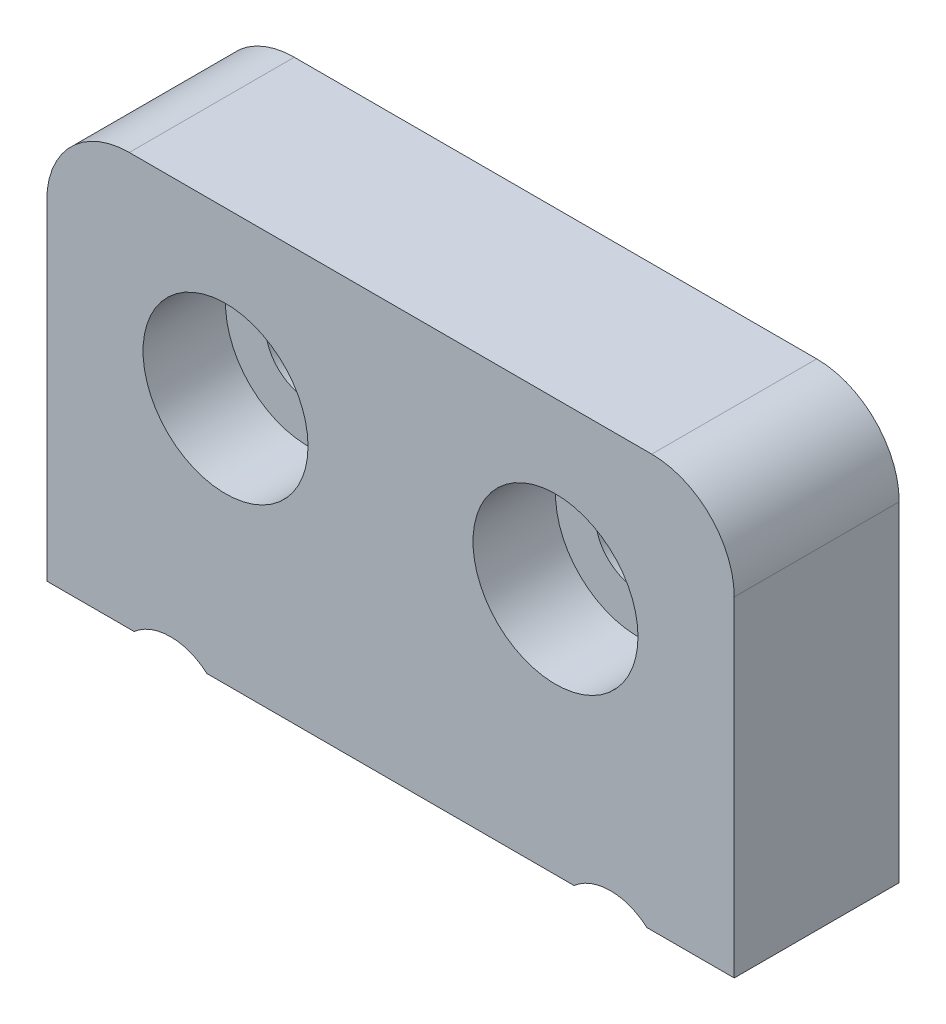
from build123d import *

# Parameters (mm, degrees)
SKETCH_1_W          = 25
SKETCH_1_H          = 15
SKETCH_1_R          = 1.55
EXTRUDE_1_DEPTH     = 6
SKETCH_3_R          = 1.5
CUT_EXTRUDE_1_DEPTH = 6
CUT_EXTRUDE_2_DEPTH = 30.765752132
FILLET_1_R          = 3
SKETCH_5_R          = 3
CUT_EXTRUDE_3_DEPTH = 3


with BuildPart() as part:
    # ｽｹｯﾁ1 → ﾎﾞｽ - 押し出し1 (new body)
    with BuildSketch(Plane.XY):
        with Locations((12.5, 7.5)):
            Rectangle(SKETCH_1_W, SKETCH_1_H)
        with Locations((6.5, 9)):
            Circle(SKETCH_1_R, mode=Mode.SUBTRACT)
        with Locations(Location((18.5, 9, 0), (0, 0, 180))):
            Circle(SKETCH_1_R, mode=Mode.SUBTRACT)
    extrude(amount=EXTRUDE_1_DEPTH)

    # ｽｹｯﾁ3 → ｶｯﾄ - 押し出し1 (cut)
    with BuildSketch(Plane.XZ):
        with Locations(Location((4.5, 3, 0), (0, 0, 270))):
            Circle(SKETCH_3_R)
        with Locations(Location((20.5, 3, 0), (0, 0, 90))):
            Circle(SKETCH_3_R)
    extrude(amount=-CUT_EXTRUDE_1_DEPTH, mode=Mode.SUBTRACT)

    # ｽｹｯﾁ4 → ｶｯﾄ - 押し出し2 (cut, through all)
    with BuildSketch(Plane.XY.offset(6)):
        with BuildLine():
            Line((3.177124344, 0), (5.822875656, 0))
            ThreePointArc((5.822875656, 0), (4.5, 0.5), (3.177124344, 0))
        make_face()
        with BuildLine():
            Line((21.822875656, 0), (19.177124344, 0))
            ThreePointArc((19.177124344, 0), (20.5, 0.5), (21.822875656, 0))
        make_face()
    extrude(amount=-CUT_EXTRUDE_2_DEPTH, mode=Mode.SUBTRACT)

    # ﾌｨﾚｯﾄ1
    fillet_1_edges = [part.edges().sort_by_distance(p)[0] for p in [
        (0, 15, 3),
        (25, 15, 3),
    ]]
    fillet(fillet_1_edges, radius=FILLET_1_R)

    # ｽｹｯﾁ5 → ｶｯﾄ - 押し出し3 (cut)
    with BuildSketch(Plane.XY.offset(6)):
        with Locations((6.5, 9)):
            Circle(SKETCH_5_R)
        with Locations((18.5, 9)):
            Circle(SKETCH_5_R)
    extrude(amount=-CUT_EXTRUDE_3_DEPTH, mode=Mode.SUBTRACT)


solid = part.part
